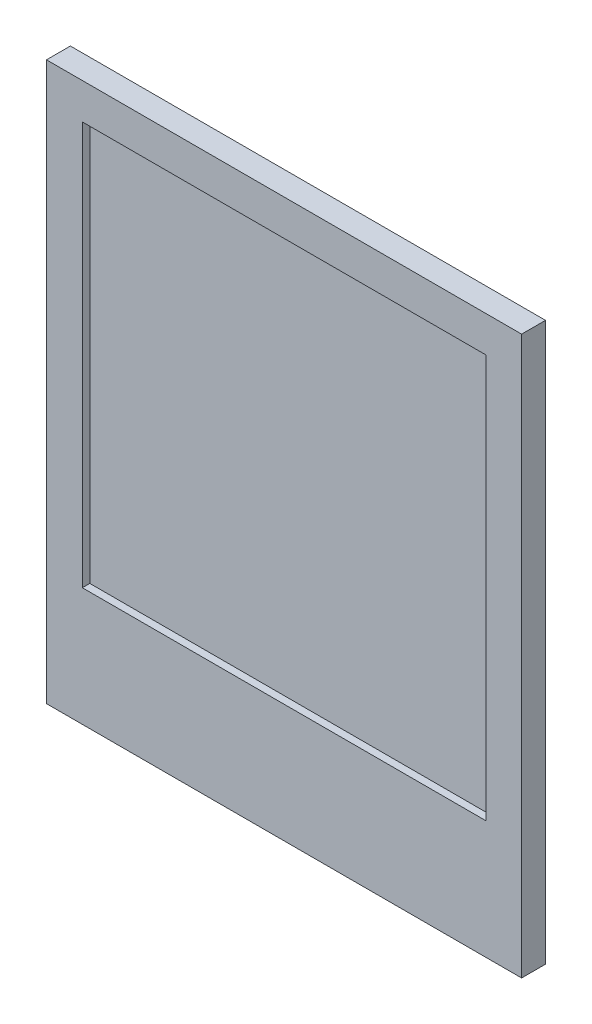
from build123d import *

# Parameters (mm, degrees)
SKETCH_1_W          = 31.8
SKETCH_1_H          = 37.32
EXTRUDE_1_DEPTH     = 1.6
SKETCH_2_W          = 27
SKETCH_2_H          = 27
CUT_EXTRUDE_1_DEPTH = 0.5


with BuildPart() as part:
    # 草图1 → 凸台-拉伸1 (new body)
    with BuildSketch(Plane.XY):
        Rectangle(SKETCH_1_W, SKETCH_1_H)
    extrude(amount=EXTRUDE_1_DEPTH)

    # 草图2 → 切除-拉伸1 (cut)
    with BuildSketch(Plane.XY.offset(1.6)):
        with Locations((0, 2.76)):
            Rectangle(SKETCH_2_W, SKETCH_2_H)
    extrude(amount=-CUT_EXTRUDE_1_DEPTH, mode=Mode.SUBTRACT)


solid = part.part
